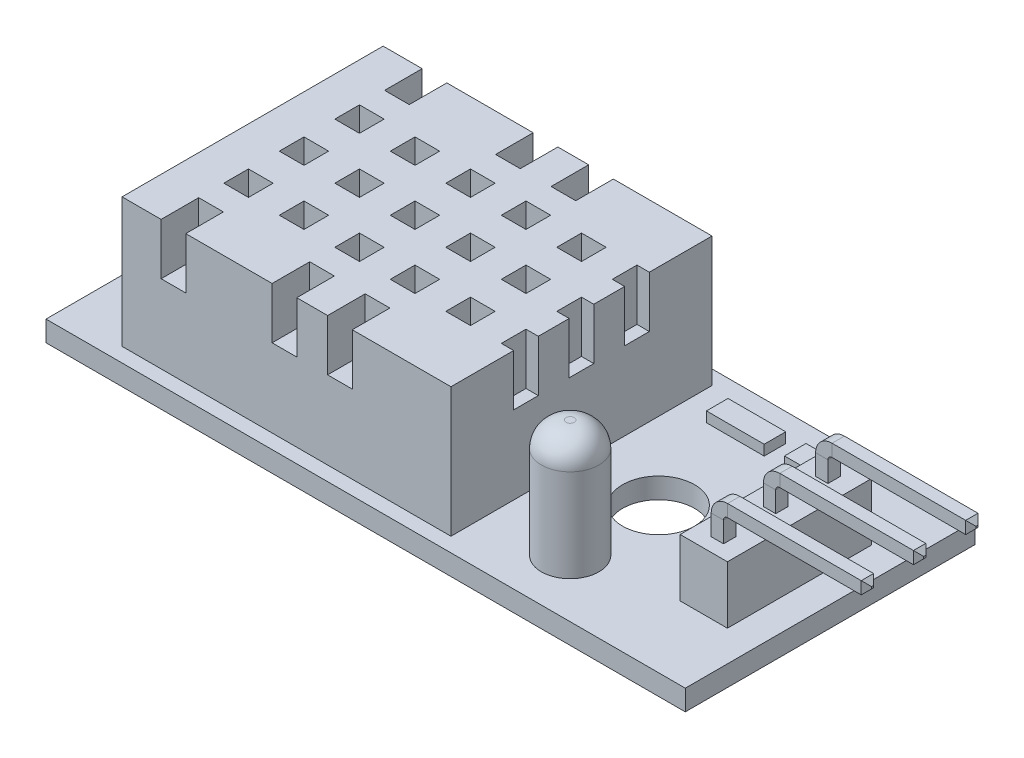
from build123d import *

# Parameters (mm, degrees)
SKETCH_1_W             = 31.1
SKETCH_1_H             = 14.1
EXTRUDE_1_DEPTH        = 1
SKETCH_2_W             = 16
SKETCH_2_H             = 12.7
EXTRUDE_2_DEPTH        = 6.3
SKETCH_3_R             = 1.75
CUT_EXTRUDE_1_DEPTH    = 19.198763694
SKETCH_4_R             = 1.4
EXTRUDE_3_DEPTH        = 5.7
FILLET_1_R             = 1.2
SKETCH_5_W             = 2.3
SKETCH_5_H             = 7
EXTRUDE_4_DEPTH        = 2.8
SKETCH_6_W             = 0.6
SKETCH_6_H             = 0.6
PATTERN_LINEAR_1_COUNT = 2
PATTERN_LINEAR_1_PITCH = 2.54
PATTERN_LINEAR_2_COUNT = 2
PATTERN_LINEAR_2_PITCH = 2.54
CHAMFER_1_SIZE         = 0.25
SKETCH_7_W             = 2.808166855
SKETCH_7_H             = 1.049205199
SKETCH_7_W_2           = 2.530436068
EXTRUDE_5_DEPTH        = 0.5
SKETCH_8_R             = 0.15
PATTERN_LINEAR_3_COUNT = 4
PATTERN_LINEAR_3_PITCH = 3.3
SKETCH_9_W             = 1.2
SKETCH_9_H             = 1.2
SKETCH_9_H_2           = 1.828804168
CUT_EXTRUDE_2_DEPTH    = 2.5


with BuildPart() as part:
    # Эскиз1 → Бобышка-Вытянуть1 (new body)
    with BuildSketch(Plane(origin=(0, 0, 0), x_dir=(1, 0, 0), z_dir=(0, 1, 0))):
        Rectangle(SKETCH_1_W, SKETCH_1_H)
    extrude(amount=EXTRUDE_1_DEPTH)

    # Эскиз2 → Бобышка-Вытянуть2 (add)
    with BuildSketch(Plane(origin=(0, 1, 0), x_dir=(1, 0, 0), z_dir=(0, 1, 0))):
        with Locations((-4.55, 0)):
            Rectangle(SKETCH_2_W, SKETCH_2_H)
    extrude(amount=EXTRUDE_2_DEPTH)

    # Эскиз3 → Вырез-Вытянуть1 (cut, through all)
    with BuildSketch(Plane(origin=(0, 1, 0), x_dir=(1, 0, 0), z_dir=(0, 1, 0))):
        with Locations(Location((7.2, 0, 0), (0, 0, 270))):
            Circle(SKETCH_3_R)
    extrude(amount=-CUT_EXTRUDE_1_DEPTH, mode=Mode.SUBTRACT)

    # Эскиз4 → Бобышка-Вытянуть3 (add)
    with BuildSketch(Plane(origin=(0, 1, 0), x_dir=(1, 0, 0), z_dir=(0, 1, 0))):
        with Locations(Location((7.15, -4.25, 0), (0, 0, 270))):
            Circle(SKETCH_4_R)
    extrude(amount=EXTRUDE_3_DEPTH)

    # Скругление1
    fillet_1_edges = [part.edges().sort_by_distance(p)[0] for p in [
        (7.15, 6.7, 2.85),
    ]]
    fillet(fillet_1_edges, radius=FILLET_1_R)

    # Эскиз5 → Бобышка-Вытянуть4 (add)
    with BuildSketch(Plane(origin=(0, 1, 0), x_dir=(1, 0, 0), z_dir=(0, 1, 0))):
        with Locations((12.9, 0)):
            Rectangle(SKETCH_5_W, SKETCH_5_H)
    extrude(amount=EXTRUDE_4_DEPTH)

    # По траектории1: sweep along a curve in space
    with BuildLine() as sweep_1_path:
        Line((12.9, 3.8, 0), (12.9, 4.8, 0))
        ThreePointArc((12.9, 4.8, 0), (13.046446609, 5.153553391, 0), (13.4, 5.3, 0))
        Line((13.4, 5.3, 0), (20.15, 5.3, 0))
    # Эскиз6 → По траектории1 (sweep)
    with BuildSketch(Plane(origin=(0, 3.8, 0), x_dir=(1, 0, 0), z_dir=(0, 1, 0))):
        with Locations((12.9, 0)):
            Rectangle(SKETCH_6_W, SKETCH_6_H)
    sweep_1 = sweep(path=sweep_1_path.line)

    # Линейный массив1: По траектории1 ×2
    with Locations(*[(0, 0, i * PATTERN_LINEAR_1_PITCH) for i in range(1, PATTERN_LINEAR_1_COUNT)]):
        add(sweep_1)

    # Линейный массив2: По траектории1 ×2
    with Locations(*[(0, 0, -i * PATTERN_LINEAR_2_PITCH) for i in range(1, PATTERN_LINEAR_2_COUNT)]):
        add(sweep_1)

    # Фаска1
    chamfer_1_edges = [part.edges().sort_by_distance(p)[0] for p in [
        (20.15, 5.3, -2.24),
        (20.15, 5, 0),
        (20.15, 5.3, -0.3),
        (20.15, 5.6, 0),
        (20.15, 5.3, 0.3),
        (20.15, 5, 2.54),
        (20.15, 5.3, 2.24),
        (20.15, 5.6, 2.54),
        (20.15, 5.3, 2.84),
        (20.15, 5, -2.54),
        (20.15, 5.3, -2.84),
        (20.15, 5.6, -2.54),
    ]]
    chamfer(chamfer_1_edges, length=CHAMFER_1_SIZE)

    # Эскиз7 → Бобышка-Вытянуть5 (add)
    with BuildSketch(Plane(origin=(0, 1, 0), x_dir=(1, 0, 0), z_dir=(0, 1, 0))):
        with Locations((6.287343289, 5.170597973)):
            Rectangle(SKETCH_7_W, SKETCH_7_H)
        with Locations((9.944131996, 5.170597973)):
            Rectangle(SKETCH_7_W_2, SKETCH_7_H)
    extrude(amount=EXTRUDE_5_DEPTH)

    # По траектории2: sweep along a curve in space
    with BuildLine() as sweep_2_path:
        Line((-12.55, 3.6, -5), (-12.999732268, 3.6, -5))
        ThreePointArc((-12.999732268, 3.6, -5), (-13.353285658, 3.453553391, -5), (-13.499732268, 3.1, -5))
        Line((-13.499732268, 3.1, -5), (-13.499732268, 1, -5))
    # Эскиз8 → По траектории2 (sweep)
    with BuildSketch(Plane.ZY.offset(12.55)):
        with Locations((-5, 3.6)):
            Circle(SKETCH_8_R)
    sweep_2 = sweep(path=sweep_2_path.line)

    # Линейный массив3: По траектории2 ×4
    with Locations(*[(0, 0, i * PATTERN_LINEAR_3_PITCH) for i in range(1, PATTERN_LINEAR_3_COUNT)]):
        add(sweep_2)

    # Эскиз9 → Вырез-Вытянуть2 (cut)
    with BuildSketch(Plane(origin=(0, 7.3, 0), x_dir=(1, 0, 0), z_dir=(0, 1, 0))):
        with Locations((3.45, 0)):
            Rectangle(SKETCH_9_W, SKETCH_9_H)
        with Locations((0.75, 0)):
            Rectangle(SKETCH_9_W, SKETCH_9_H)
        with Locations((-1.95, 0)):
            Rectangle(SKETCH_9_W, SKETCH_9_H)
        with Locations((-4.65, 0)):
            Rectangle(SKETCH_9_W, SKETCH_9_H)
        with Locations((-7.35, 0)):
            Rectangle(SKETCH_9_W, SKETCH_9_H)
        with Locations((-10.05, 0)):
            Rectangle(SKETCH_9_W, SKETCH_9_H)
        with Locations((3.45, 2.7)):
            Rectangle(SKETCH_9_W, SKETCH_9_H)
        with Locations((0.75, 2.7)):
            Rectangle(SKETCH_9_W, SKETCH_9_H)
        with Locations((-1.95, 2.7)):
            Rectangle(SKETCH_9_W, SKETCH_9_H)
        with Locations((-4.65, 2.7)):
            Rectangle(SKETCH_9_W, SKETCH_9_H)
        with Locations((-7.35, 2.7)):
            Rectangle(SKETCH_9_W, SKETCH_9_H)
        with Locations((-10.05, 2.7)):
            Rectangle(SKETCH_9_W, SKETCH_9_H)
        with Locations((3.45, -2.7)):
            Rectangle(SKETCH_9_W, SKETCH_9_H)
        with Locations((0.75, -2.7)):
            Rectangle(SKETCH_9_W, SKETCH_9_H)
        with Locations((-1.95, -2.7)):
            Rectangle(SKETCH_9_W, SKETCH_9_H)
        with Locations((-4.65, -2.7)):
            Rectangle(SKETCH_9_W, SKETCH_9_H)
        with Locations((-7.35, -2.7)):
            Rectangle(SKETCH_9_W, SKETCH_9_H)
        with Locations((-10.05, -2.7)):
            Rectangle(SKETCH_9_W, SKETCH_9_H)
        with Locations((-10.05, 5.435597916)):
            Rectangle(SKETCH_9_W, SKETCH_9_H_2)
        with Locations((-4.65, 5.435597916)):
            Rectangle(SKETCH_9_W, SKETCH_9_H_2)
        with Locations((-1.95, 5.435597916)):
            Rectangle(SKETCH_9_W, SKETCH_9_H_2)
        with Locations((-1.95, -5.435597916)):
            Rectangle(SKETCH_9_W, SKETCH_9_H_2)
        with Locations((-4.65, -5.435597916)):
            Rectangle(SKETCH_9_W, SKETCH_9_H_2)
        with Locations((-10.05, -5.435597916)):
            Rectangle(SKETCH_9_W, SKETCH_9_H_2)
    extrude(amount=-CUT_EXTRUDE_2_DEPTH, mode=Mode.SUBTRACT)


solid = part.part
